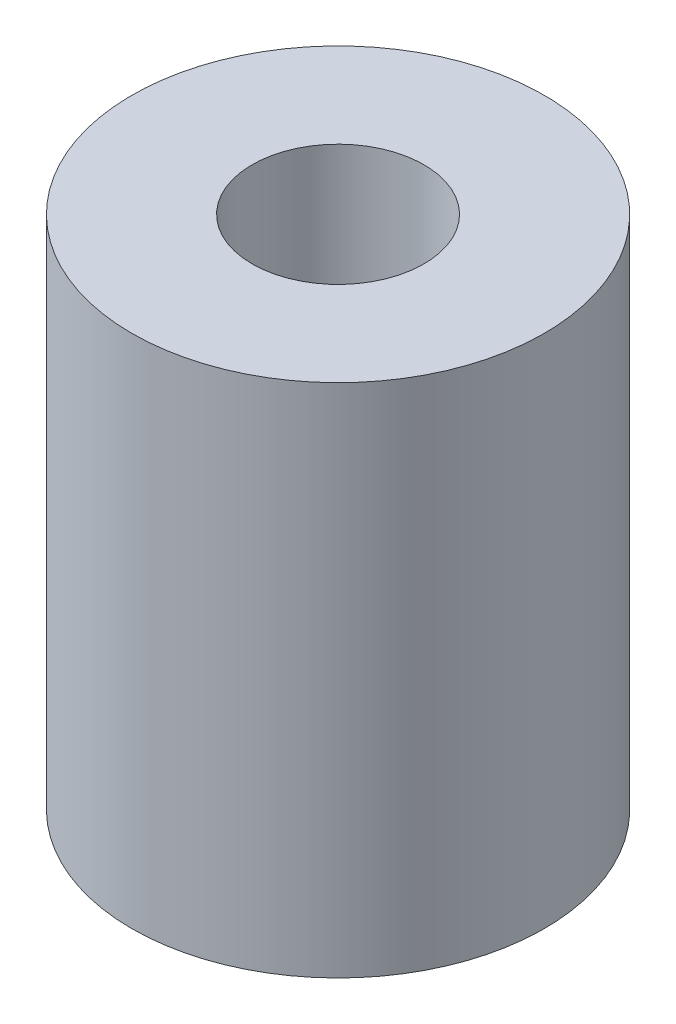
from build123d import *

# Parameters (mm, degrees)
SKETCH1_R           = 6
BOSS_EXTRUDE1_DEPTH = 15
SKETCH4_R           = 2.5
CUT_EXTRUDE2_DEPTH  = 18.23368794


with BuildPart() as part:
    # Sketch1 → Boss-Extrude1 (new body)
    with BuildSketch(Plane(origin=(0, 0, 0), x_dir=(1, 0, 0), z_dir=(0, 1, 0))):
        with Locations(Location((0, 0, 0), (0, 0, 270))):
            Circle(SKETCH1_R)
    extrude(amount=BOSS_EXTRUDE1_DEPTH)

    # Sketch4 → Cut-Extrude2 (cut, through all)
    with BuildSketch(Plane(origin=(0, 15, 0), x_dir=(1, 0, 0), z_dir=(0, 1, 0))):
        with Locations(Location((0, 0, 0), (0, 0, 270))):
            Circle(SKETCH4_R)
    extrude(amount=-CUT_EXTRUDE2_DEPTH, mode=Mode.SUBTRACT)


solid = part.part
